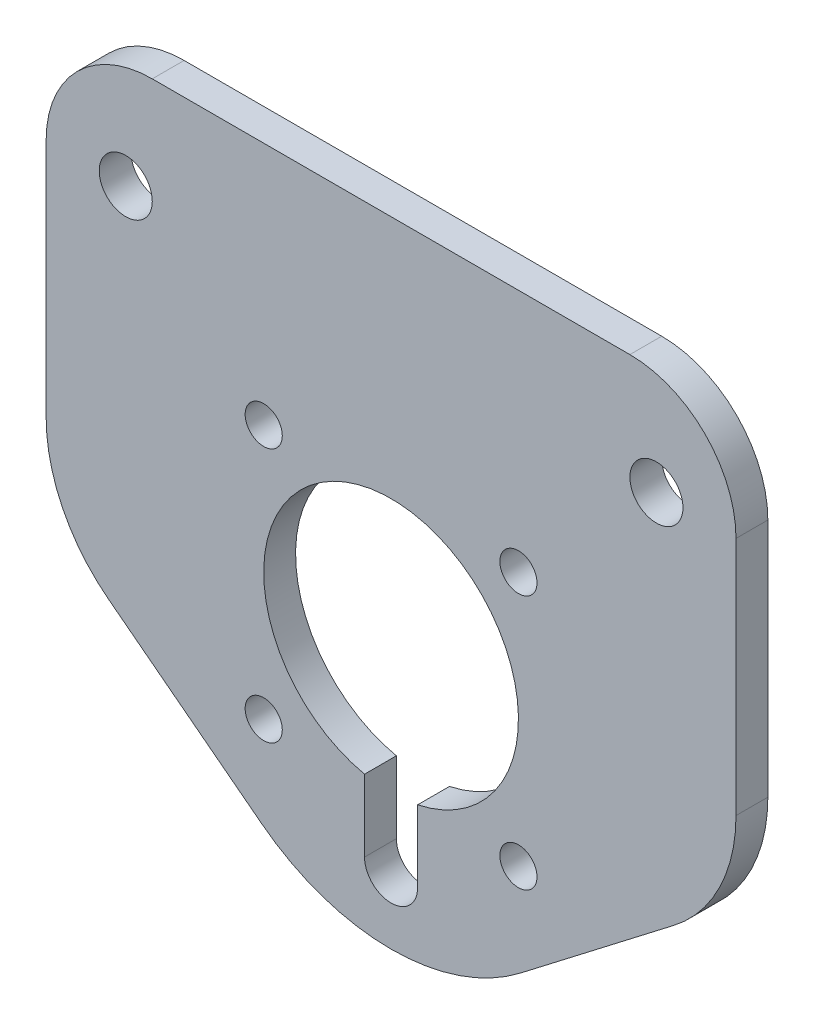
from build123d import *
from OCP.BRepFilletAPI import BRepFilletAPI_MakeFillet

# Parameters (mm, degrees)
SKETCH1_R           = 2.5
BOSS_EXTRUDE1_DEPTH = 3
FILLET1_R1          = 10
FILLET1_R2          = 15
FILLET1_R3          = 20
SKETCH2_R           = 1.75
SKETCH2_R_2         = 12
CUT_EXTRUDE1_DEPTH  = 45.331140297


with BuildPart() as part:
    # Sketch1 → Boss-Extrude1 (new body)
    with BuildSketch(Plane.XY):
        Polygon((-32.5, 30), (32.5, 30), (32.5, -10), (0, -35), (-32.5, -10), align=None)
        with Locations((25, 20)):
            Circle(SKETCH1_R, mode=Mode.SUBTRACT)
        with Locations((-25, 20)):
            Circle(SKETCH1_R, mode=Mode.SUBTRACT)
        with BuildLine():
            Line((2.5, -16.5), (2.5, -23.5))
            ThreePointArc((2.5, -23.5), (0, -26), (-2.5, -23.5))
            Line((-2.5, -23.5), (-2.5, -16.5))
            ThreePointArc((-2.5, -16.5), (0, -14), (2.5, -16.5))
        make_face(mode=Mode.SUBTRACT)
    extrude(amount=BOSS_EXTRUDE1_DEPTH)

    # Fillet1: one fillet with a radius per group of edges: ONE call of the kernel's fillet builder (fillet() takes one radius for all edges)
    fillet1_edges_1 = [part.edges().sort_by_distance(p)[0] for p in [
        (32.5, 30, 1.5),
        (-32.5, 30, 1.5),
    ]]
    fillet1_edges_2 = [part.edges().sort_by_distance(p)[0] for p in [
        (-32.5, -10, 1.5),
        (32.5, -10, 1.5),
    ]]
    fillet1_edges_3 = [part.edges().sort_by_distance(p)[0] for p in [
        (0, -35, 1.5),
    ]]
    fillet1 = BRepFilletAPI_MakeFillet(part.part.solid().wrapped)
    for e in fillet1_edges_1:
        fillet1.Add(FILLET1_R1, e.wrapped)
    for e in fillet1_edges_2:
        fillet1.Add(FILLET1_R2, e.wrapped)
    for e in fillet1_edges_3:
        fillet1.Add(FILLET1_R3, e.wrapped)
    add(Compound.cast(fillet1.Shape()), mode=Mode.REPLACE)

    # Sketch2 → Cut-Extrude1 (cut, through all)
    with BuildSketch(Plane.XY.offset(3)):
        with Locations((12, 7)):
            Circle(SKETCH2_R)
        with Locations((12, -17)):
            Circle(SKETCH2_R)
        with Locations((-12, -17)):
            Circle(SKETCH2_R)
        with Locations((-12, 7)):
            Circle(SKETCH2_R)
        with Locations((0, -5)):
            Circle(SKETCH2_R_2)
    extrude(amount=-CUT_EXTRUDE1_DEPTH, mode=Mode.SUBTRACT)


solid = part.part
